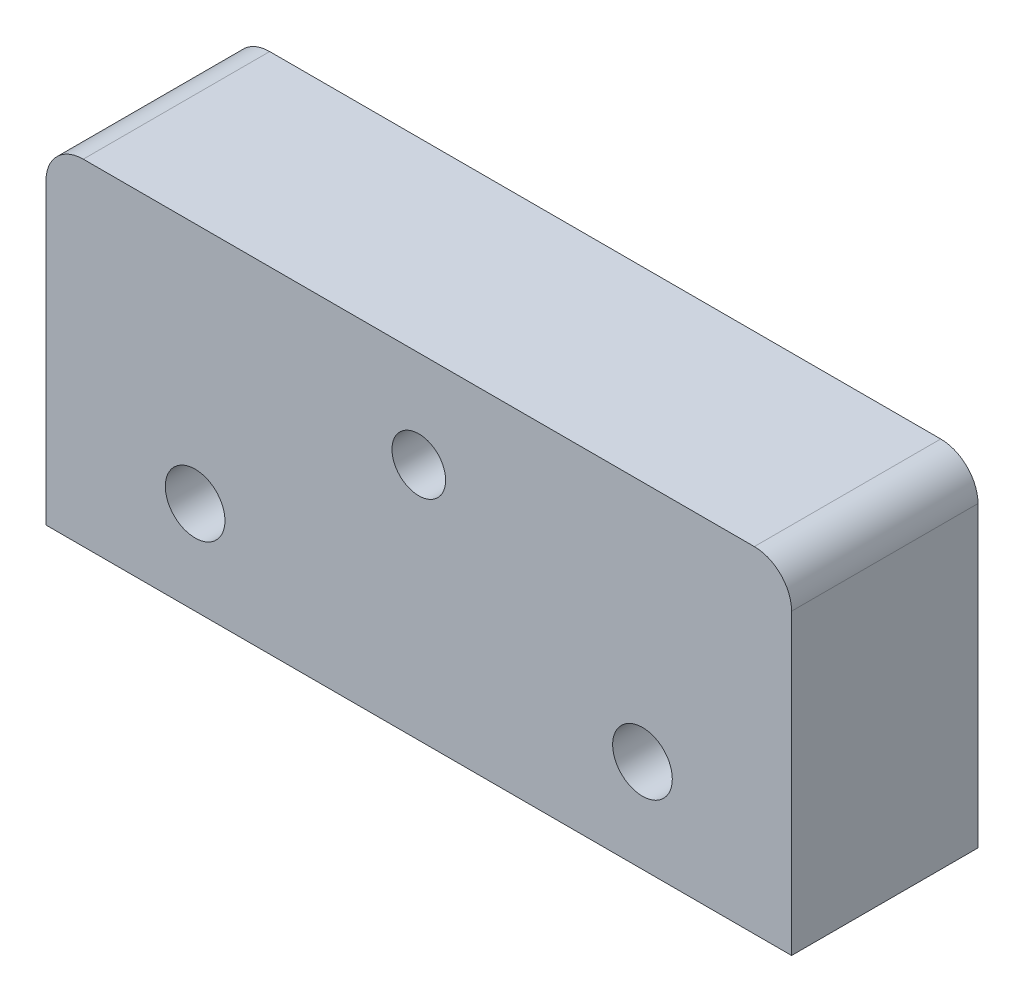
from build123d import *

# Parameters (mm, degrees)
SKETCH1_W           = 100
SKETCH1_H           = 45
SKETCH1_R           = 4
SKETCH1_R_2         = 3.6
BOSS_EXTRUDE1_DEPTH = 25
SKETCH1_3_R         = 11
CUT_EXTRUDE1_DEPTH  = 7.5
FILLET1_R           = 5
SKETCH1_4_R         = 7
CUT_EXTRUDE2_DEPTH  = 8


with BuildPart() as part:
    # Sketch1 → Boss-Extrude1 (new body)
    with BuildSketch(Plane.XY):
        with Locations((50, 22.5)):
            Rectangle(SKETCH1_W, SKETCH1_H)
        with Locations((20, 12.5)):
            Circle(SKETCH1_R, mode=Mode.SUBTRACT)
        with Locations((80, 12.5)):
            Circle(SKETCH1_R, mode=Mode.SUBTRACT)
        with Locations((50, 32)):
            Circle(SKETCH1_R_2, mode=Mode.SUBTRACT)
    extrude(amount=BOSS_EXTRUDE1_DEPTH)

    # Sketch1<3> → Cut-Extrude1 (cut)
    with BuildSketch(Plane.XY):
        with Locations((50, 32)):
            Circle(SKETCH1_3_R)
    extrude(amount=CUT_EXTRUDE1_DEPTH, mode=Mode.SUBTRACT)

    # Fillet1
    fillet1_edges = [part.edges().sort_by_distance(p)[0] for p in [
        (100, 45, 12.5),
        (0, 45, 12.5),
    ]]
    fillet(fillet1_edges, radius=FILLET1_R)

    # Sketch1<4> → Cut-Extrude2 (cut)
    with BuildSketch(Plane.XY):
        with Locations((80, 12.5)):
            Circle(SKETCH1_4_R)
        with Locations((20, 12.5)):
            Circle(SKETCH1_4_R)
    extrude(amount=CUT_EXTRUDE2_DEPTH, mode=Mode.SUBTRACT)


solid = part.part
